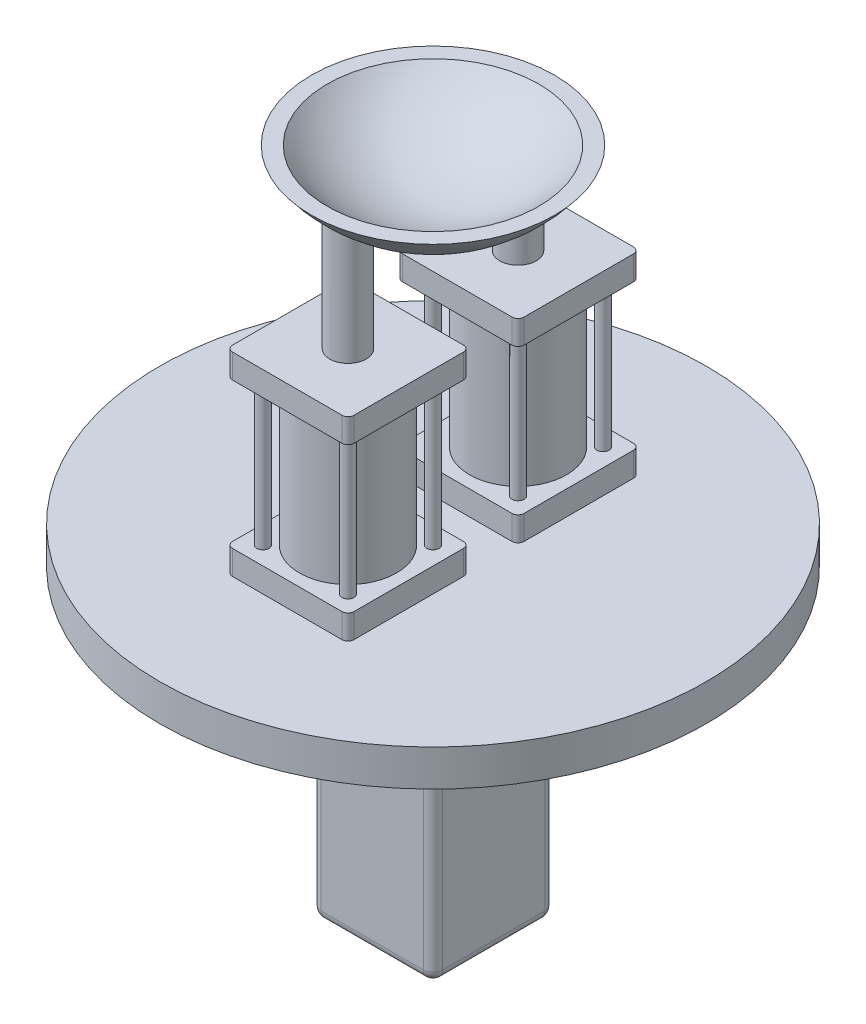
from build123d import *

# Parameters (mm, degrees)
SKETCH1_R                = 225
BOSS_EXTRUDE1_DEPTH      = 30
SHELL1_T                 = -10
SKETCH8_W                = 100
SKETCH8_H                = 100
BOSS_EXTRUDE2_DEPTH      = 20
BOSS_EXTRUDE2_2_DEPTH    = 20
SKETCH9_R                = 17.5
BOSS_EXTRUDE3_DEPTH      = 100
SKETCH11_W               = 100
SKETCH11_H               = 100
BOSS_EXTRUDE4_DEPTH      = 150
FILLET1_R                = 8
FILLET2_R                = 8
SKETCH14_R               = 40
BOSS_EXTRUDE6_DEPTH      = 120
SKETCH15_W               = 100
SKETCH15_H               = 100
BOSS_EXTRUDE7_DEPTH      = 20
BOSS_EXTRUDE8_REACH      = 545.001
BOSS_EXTRUDE8_END_RADIUS = 125
SKETCH16_R               = 15
FILLET3_R                = 5
FILLET4_R                = 5
FILLET5_R                = 5
SKETCH17_R               = 5
BOSS_EXTRUDE9_DEPTH      = 120
BOSS_EXTRUDE9_2_DEPTH    = 120
BOSS_EXTRUDE9_3_DEPTH    = 120
BOSS_EXTRUDE9_4_DEPTH    = 120


with BuildPart() as part:
    # Sketch1 → Boss-Extrude1 (new body)
    with BuildSketch(Plane(origin=(0, 0, 0), x_dir=(1, 0, 0), z_dir=(0, 1, 0))):
        with Locations(Location((0, 0, 0), (0, 0, 270))):
            Circle(SKETCH1_R)
    extrude(amount=BOSS_EXTRUDE1_DEPTH)


with BuildPart() as body_2:
    # Sketch7 → Revolve1 (revolve)
    with BuildSketch(Plane(origin=(0, 0, 0), x_dir=(0, 0, -1), z_dir=(1, 0, 0))):
        with BuildLine():
            Line((100, 300), (0, 300))
            Line((0, 300), (0, 250))
            ThreePointArc((0, 250), (55.901699437, 263.196601125), (100, 300))
        make_face()
    revolve(axis=Axis((0, 300, 0), (0, -1, 0)))

    # Shell1
    shell1_openings = [body_2.faces().sort_by_distance(p)[0] for p in [
        (0, 300, 0),
    ]]
    offset(amount=SHELL1_T, openings=shell1_openings, kind=Kind.INTERSECTION)



with BuildPart() as body_3:
    # Sketch8 → Boss-Extrude2 (new body)
    with BuildSketch(Plane(origin=(0, 30, 0), x_dir=(1, 0, 0), z_dir=(0, 1, 0))):
        with Locations((0, 70)):
            Rectangle(SKETCH8_W, SKETCH8_H)
    extrude(amount=BOSS_EXTRUDE2_DEPTH)

    # Fillet4
    fillet4_edges = [body_3.edges().sort_by_distance(p)[0] for p in [
        (50, 40, -20),
        (-50, 40, -20),
        (-50, 40, -120),
        (50, 40, -120),
    ]]
    fillet(fillet4_edges, radius=FILLET4_R)


with BuildPart() as body_4:
    # Sketch8 → Boss-Extrude2 2 (new body)
    with BuildSketch(Plane(origin=(0, 30, 0), x_dir=(1, 0, 0), z_dir=(0, 1, 0))):
        with Locations((0, -70)):
            Rectangle(SKETCH8_W, SKETCH8_H)
    extrude(amount=BOSS_EXTRUDE2_2_DEPTH)

    # Fillet5
    fillet5_edges = [body_4.edges().sort_by_distance(p)[0] for p in [
        (-50, 40, 20),
        (50, 40, 20),
        (50, 40, 120),
        (-50, 40, 120),
    ]]
    fillet(fillet5_edges, radius=FILLET5_R)


with BuildPart() as body_5:
    # Sketch9 → Boss-Extrude3 (new body)
    with BuildSketch(Plane.XZ):
        with Locations(Location((0, 0, 0), (0, 0, 270))):
            Circle(SKETCH9_R)
    extrude(amount=BOSS_EXTRUDE3_DEPTH)


with BuildPart() as body_6:
    # Sketch11 → Boss-Extrude4 (new body)
    with BuildSketch(Plane.XZ.offset(100)):
        Rectangle(SKETCH11_W, SKETCH11_H)
    extrude(amount=BOSS_EXTRUDE4_DEPTH)

    # Fillet1
    fillet1_edges = [body_6.edges().sort_by_distance(p)[0] for p in [
        (50, -175, -50),
        (-50, -175, -50),
        (-50, -175, 50),
        (50, -175, 50),
    ]]
    fillet(fillet1_edges, radius=FILLET1_R)

    # Fillet2
    fillet2_edges = [body_6.edges().sort_by_distance(p)[0] for p in [
        (-50, -250, 0),
        (0, -250, 50),
        (50, -250, 0),
        (0, -250, -50),
        (47.656854249, -250, 47.656854249),
        (47.656854249, -250, -47.656854249),
        (-47.656854249, -250, -47.656854249),
        (-47.656854249, -250, 47.656854249),
    ]]
    fillet(fillet2_edges, radius=FILLET2_R)


with BuildPart() as body_7:
    # Sketch14 → Boss-Extrude6 (new body)
    with BuildSketch(Plane(origin=(0, 50, 0), x_dir=(1, 0, 0), z_dir=(0, 1, 0))):
        with Locations(Location((0, 70, 0), (0, 0, 270))):
            Circle(SKETCH14_R)
    extrude(amount=BOSS_EXTRUDE6_DEPTH)


with BuildPart() as body_8:
    # Sketch15 → Boss-Extrude7 (new body)
    with BuildSketch(Plane(origin=(0, 170, 0), x_dir=(1, 0, 0), z_dir=(0, 1, 0))):
        with Locations((0, 70)):
            Rectangle(SKETCH15_W, SKETCH15_H)
    extrude(amount=BOSS_EXTRUDE7_DEPTH)


with BuildPart() as body_9:
    # Mirror1: mirrored copy
    add(body_8.part.mirror(Plane.XY))


with BuildPart() as body_10:
    # Mirror1 2: mirrored copy
    add(body_7.part.mirror(Plane.XY))


with BuildPart() as body_2_1:
    add(body_2.part)

    add(body_8.part)  # Boss-Extrude8 merges body 8

    add(body_9.part)  # Boss-Extrude8 merges body 9
    # Boss-Extrude8: up to this sphere (the profile starts outside it)
    boss_extrude8_end = Location((0, 375, 0)) * Sphere(BOSS_EXTRUDE8_END_RADIUS, mode=Mode.PRIVATE)
    # Sketch16 → Boss-Extrude8 (add, up to the surface)
    with BuildSketch(Plane(origin=(0, 190, 0), x_dir=(1, 0, 0), z_dir=(0, 1, 0)), mode=Mode.PRIVATE) as boss_extrude8_sk1:
        with Locations(Location((0, 70, 0), (0, 0, 270))):
            Circle(SKETCH16_R)
    boss_extrude8_tool1 = extrude(boss_extrude8_sk1.sketch, amount=BOSS_EXTRUDE8_REACH, mode=Mode.PRIVATE) - boss_extrude8_end
    add(boss_extrude8_tool1.solids().sort_by_distance((0, 190, -70))[0])
    # Sketch16 → Boss-Extrude8 (add, up to the surface)
    with BuildSketch(Plane(origin=(0, 190, 0), x_dir=(1, 0, 0), z_dir=(0, 1, 0)), mode=Mode.PRIVATE) as boss_extrude8_sk2:
        with Locations(Location((0, -70, 0), (0, 0, 90))):
            Circle(SKETCH16_R)
    boss_extrude8_tool2 = extrude(boss_extrude8_sk2.sketch, amount=BOSS_EXTRUDE8_REACH, mode=Mode.PRIVATE) - boss_extrude8_end
    add(boss_extrude8_tool2.solids().sort_by_distance((0, 190, 70))[0])

    # Fillet3
    fillet3_edges = [body_2_1.edges().sort_by_distance(p)[0] for p in [
        (-50, 180, -120),
        (-50, 180, -20),
        (50, 180, -20),
        (50, 180, -120),
        (-50, 180, 20),
        (50, 180, 20),
        (50, 180, 120),
        (-50, 180, 120),
    ]]
    fillet(fillet3_edges, radius=FILLET3_R)


with BuildPart() as body_9_2:
    # Sketch17 → Boss-Extrude9 (new body)
    with BuildSketch(Plane(origin=(0, 50, 0), x_dir=(1, 0, 0), z_dir=(0, 1, 0))):
        with Locations(Location((-35, 105, 0), (0, 0, 270))):
            Circle(SKETCH17_R)
    extrude(amount=BOSS_EXTRUDE9_DEPTH)


with BuildPart() as body_10_2:
    # Sketch17 → Boss-Extrude9 2 (new body)
    with BuildSketch(Plane(origin=(0, 50, 0), x_dir=(1, 0, 0), z_dir=(0, 1, 0))):
        with Locations(Location((35, 105, 0), (0, 0, 90))):
            Circle(SKETCH17_R)
    extrude(amount=BOSS_EXTRUDE9_2_DEPTH)


with BuildPart() as body_11:
    # Sketch17 → Boss-Extrude9 3 (new body)
    with BuildSketch(Plane(origin=(0, 50, 0), x_dir=(1, 0, 0), z_dir=(0, 1, 0))):
        with Locations(Location((35, 35, 0), (0, 0, 270))):
            Circle(SKETCH17_R)
    extrude(amount=BOSS_EXTRUDE9_3_DEPTH)


with BuildPart() as body_12:
    # Sketch17 → Boss-Extrude9 4 (new body)
    with BuildSketch(Plane(origin=(0, 50, 0), x_dir=(1, 0, 0), z_dir=(0, 1, 0))):
        with Locations(Location((-35, 35, 0), (0, 0, 90))):
            Circle(SKETCH17_R)
    extrude(amount=BOSS_EXTRUDE9_4_DEPTH)


with BuildPart() as body_13:
    # Mirror3: mirrored copy
    add(body_9_2.part.mirror(Plane.XY))


with BuildPart() as body_14:
    # Mirror3 2: mirrored copy
    add(body_12.part.mirror(Plane.XY))


with BuildPart() as body_15:
    # Mirror3 3: mirrored copy
    add(body_11.part.mirror(Plane.XY))


with BuildPart() as body_16:
    # Mirror3 4: mirrored copy
    add(body_10_2.part.mirror(Plane.XY))


solid = Compound([part.part, body_3.part, body_4.part, body_5.part, body_6.part, body_7.part, body_10.part, body_2_1.part, body_9_2.part, body_10_2.part, body_11.part, body_12.part, body_13.part, body_14.part, body_15.part, body_16.part])
